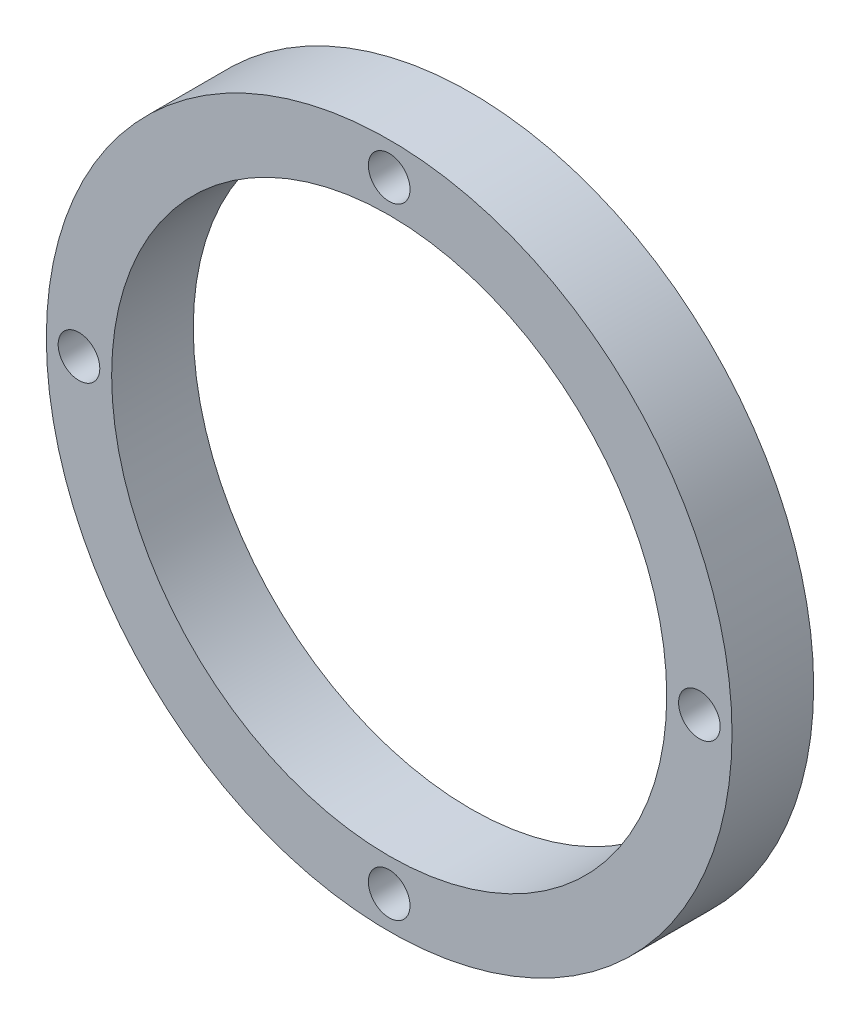
from build123d import *

# Parameters (mm, degrees)
SKETCH1_R           = 42
SKETCH1_R_2         = 34
SKETCH1_R_3         = 1.75
BOSS_EXTRUDE1_DEPTH = 10
SKETCH2_R           = 2.55
CUT_EXTRUDE1_DEPTH  = 7


with BuildPart() as part:
    # Sketch1 → Boss-Extrude1 (new body)
    with BuildSketch(Plane.XY):
        Circle(SKETCH1_R)
        Circle(SKETCH1_R_2, mode=Mode.SUBTRACT)
        with Locations((0, 38)):
            Circle(SKETCH1_R_3, mode=Mode.SUBTRACT)
        with Locations((38, 0)):
            Circle(SKETCH1_R_3, mode=Mode.SUBTRACT)
        with Locations((0, -38)):
            Circle(SKETCH1_R_3, mode=Mode.SUBTRACT)
        with Locations((-38, 0)):
            Circle(SKETCH1_R_3, mode=Mode.SUBTRACT)
    extrude(amount=BOSS_EXTRUDE1_DEPTH)

    # Sketch2 → Cut-Extrude1 (cut)
    with BuildSketch(Plane.XY.offset(10)):
        with Locations((0, 38)):
            Circle(SKETCH2_R)
        with Locations((38, 0)):
            Circle(SKETCH2_R)
        with Locations((0, -38)):
            Circle(SKETCH2_R)
        with Locations((-38, 0)):
            Circle(SKETCH2_R)
    extrude(amount=-CUT_EXTRUDE1_DEPTH, mode=Mode.SUBTRACT)


solid = part.part
